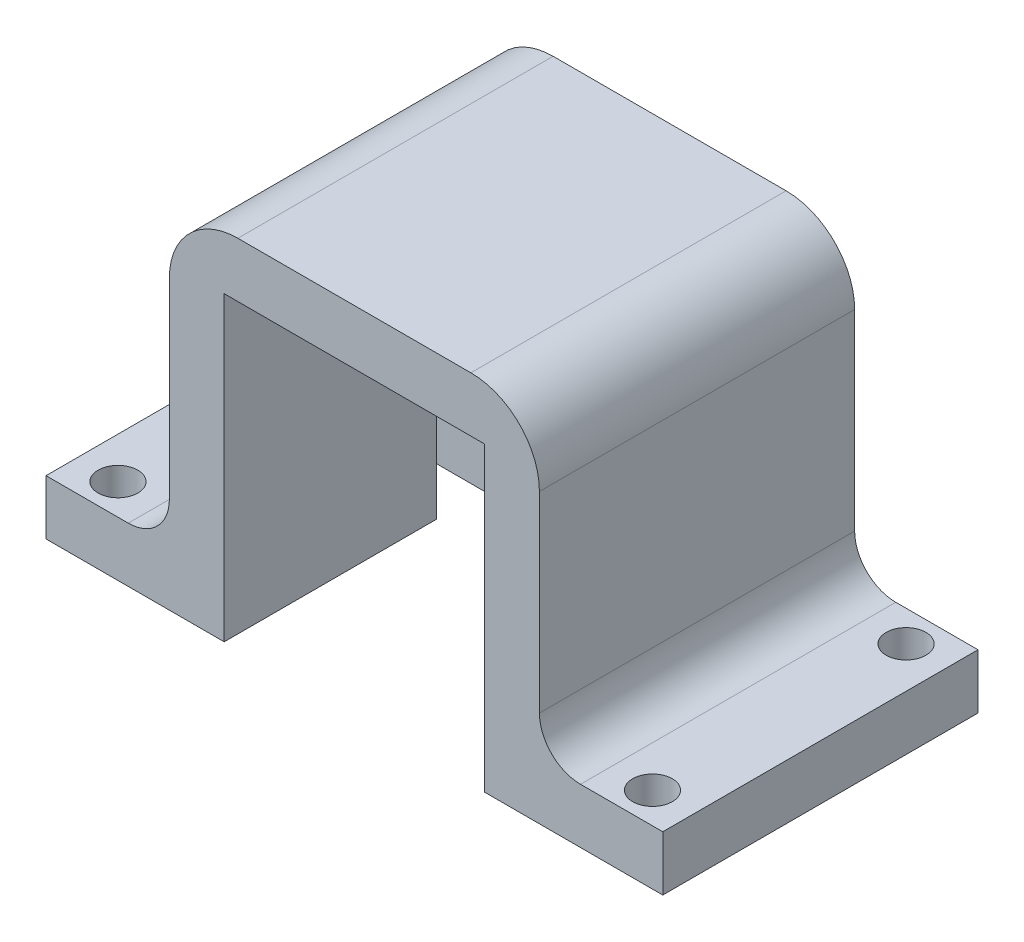
from build123d import *

# Parameters (mm, degrees)
BOSS_EXTRUDE1_DEPTH     = 23
SKETCH3_R               = 1.45
CUT_EXTRUDE1_DEPTH      = 23
CUT_EXTRUDE2_DEPTH      = 23
CUT_EXTRUDE2_DEPTH_BACK = 10
SKETCH4_W               = 3.5
SKETCH4_H               = 21


with BuildPart() as part:
    # Sketch1 → Boss-Extrude1 (new body)
    with BuildSketch(Plane.XY):
        with BuildLine():
            Line((0, 3), (0, 17))
            ThreePointArc((0, 17), (1.464466094, 20.535533906), (5, 22))
            Line((5, 22), (22, 22))
            ThreePointArc((22, 22), (25.535533906, 20.535533906), (27, 17))
            Line((27, 17), (27, 3))
            ThreePointArc((27, 3), (27.878679656, 0.878679656), (30, 0))
            Line((30, 0), (36, 0))
            Line((36, 0), (36, -4))
            Line((36, -4), (23, -4))
            Line((23, -4), (23, 18))
            Line((23, 18), (4, 18))
            Line((4, 18), (4, -4))
            Line((4, -4), (-9, -4))
            Line((-9, -4), (-9, 0))
            Line((-9, 0), (-3, 0))
            ThreePointArc((-3, 0), (-0.878679656, 0.878679656), (0, 3))
        make_face()
    extrude(amount=BOSS_EXTRUDE1_DEPTH)

    # Sketch3 → Cut-Extrude1 (cut)
    with BuildSketch(Plane(origin=(0, 0, 0), x_dir=(1, 0, 0), z_dir=(0, 1, 0))):
        with Locations(Location((-6, -2.25, 0), (0, 0, 270))):
            Circle(SKETCH3_R)
        with Locations(Location((-6, -20.75, 0), (0, 0, 270))):
            Circle(SKETCH3_R)
        with Locations(Location((33, -20.75, 0), (0, 0, 180))):
            Circle(SKETCH3_R)
        with Locations(Location((33, -2.25, 0), (0, 0, 180))):
            Circle(SKETCH3_R)
    extrude(amount=-CUT_EXTRUDE1_DEPTH, mode=Mode.SUBTRACT)

    # Sketch4 → Cut-Extrude2 (cut, two sides: drawn at the far end of the back side and taken through both)
    with BuildSketch(Plane.ZY.offset(-CUT_EXTRUDE2_DEPTH_BACK)):
        with Locations((5.75, 6.5)):
            Rectangle(SKETCH4_W, SKETCH4_H)
    extrude(amount=CUT_EXTRUDE2_DEPTH + CUT_EXTRUDE2_DEPTH_BACK, mode=Mode.SUBTRACT)


solid = part.part
